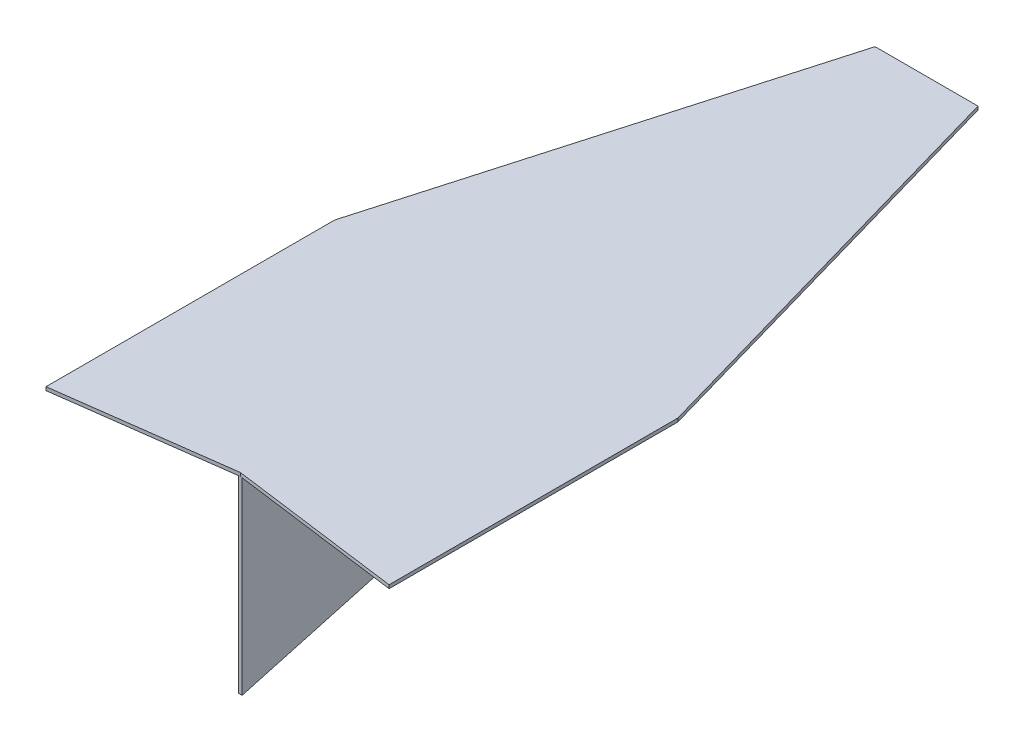
from build123d import *

# Parameters (mm, degrees)
SKETCH_1_W           = 100
SKETCH_1_H           = 210
EXTRUDE_1_DEPTH      = 1
CUT_EXTRUDE_1_DEPTH  = 1
EXTRUDE_2_DEPTH      = 0.5
EXTRUDE_2_DEPTH_BACK = 0.5


with BuildPart() as part:
    # ｽｹｯﾁ1 → ﾎﾞｽ - 押し出し1 (new body)
    with BuildSketch(Plane(origin=(0, 0, 0), x_dir=(1, 0, 0), z_dir=(0, 1, 0))):
        Rectangle(SKETCH_1_W, SKETCH_1_H)
    extrude(amount=EXTRUDE_1_DEPTH)

    # ｽｹｯﾁ2 → ｶｯﾄ - 押し出し1 (cut)
    with BuildSketch(Plane(origin=(0, 1, 0), x_dir=(1, 0, 0), z_dir=(0, 1, 0))):
        Polygon((15, 105), (50, -17.5), (50, 105), align=None)
        Polygon((-50, 105), (-50, -17.5), (-15, 105), align=None)
        Polygon((50, -105), (50, -101.666666667), (0, -95), (-50, -101.666666667), (-50, -105), align=None)
    extrude(amount=-CUT_EXTRUDE_1_DEPTH, mode=Mode.SUBTRACT)

    # ｽｹｯﾁ4 → ﾎﾞｽ - 押し出し2 (add, two sides: drawn at the far end of the back side and taken through both)
    with BuildSketch(Plane(origin=(0, 0, 0), x_dir=(0, 0, -1), z_dir=(1, 0, 0)).offset(-EXTRUDE_2_DEPTH_BACK)):
        Polygon((105, 0), (-95, -55), (-95, 0), align=None)
    extrude(amount=EXTRUDE_2_DEPTH + EXTRUDE_2_DEPTH_BACK)


solid = part.part
